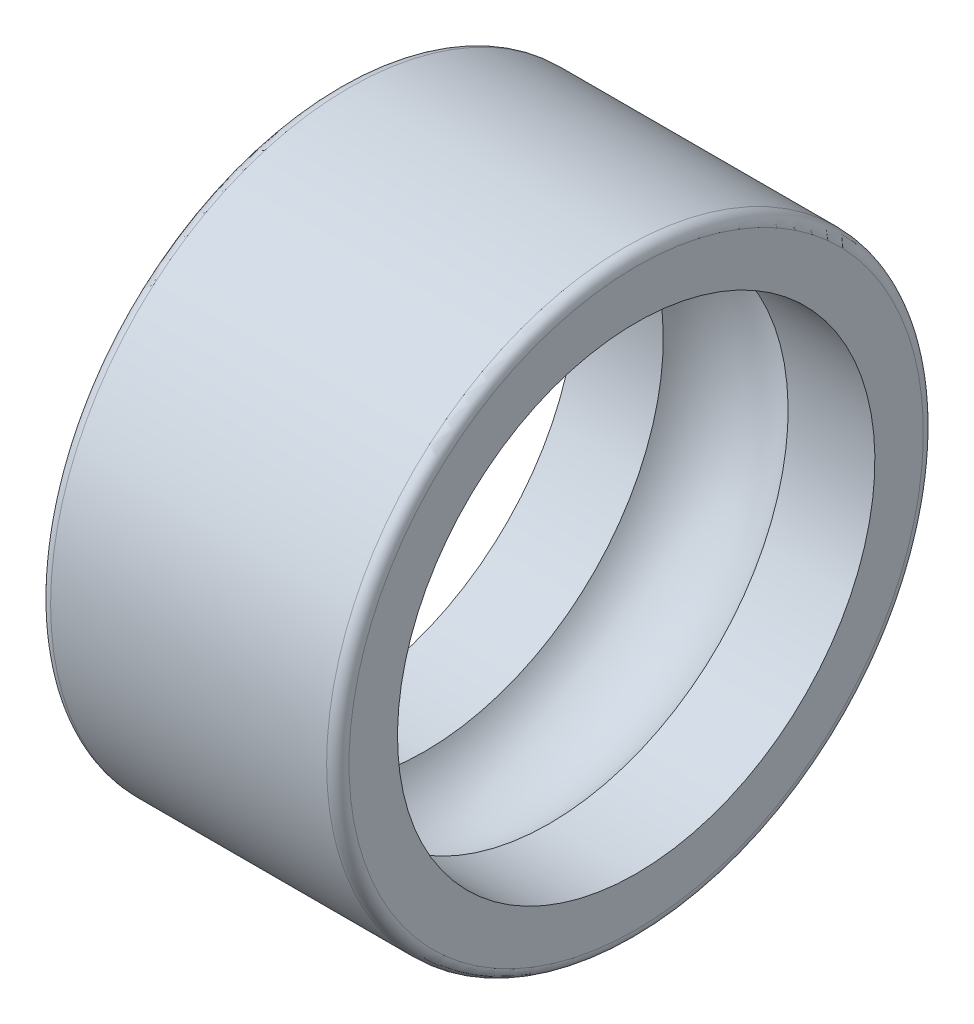
from build123d import *


with BuildPart() as part:
    # Esquisse1 → Révolution1 (revolve)
    with BuildSketch(Plane.XY, mode=Mode.PRIVATE) as r_volution1_sk:
        with BuildLine():
            Line((0.15, 4), (3.85, 4))
            ThreePointArc((3.85, 4), (3.956066017, 3.956066017), (4, 3.85))
            Line((4, 3.85), (4, 3.2))
            Line((4, 3.2), (2.836660027, 3.2))
            ThreePointArc((2.836660027, 3.2), (2, 3.7), (1.163339973, 3.2))
            Line((1.163339973, 3.2), (0, 3.2))
            Line((0, 3.2), (0, 3.85))
            ThreePointArc((0, 3.85), (0.043933983, 3.956066017), (0.15, 4))
        make_face()
    revolve(r_volution1_sk.sketch.rotate(Axis((0, 0, 0), (1, 0, 0)), 180), axis=Axis((0, 0, 0), (1, 0, 0)))


solid = part.part
